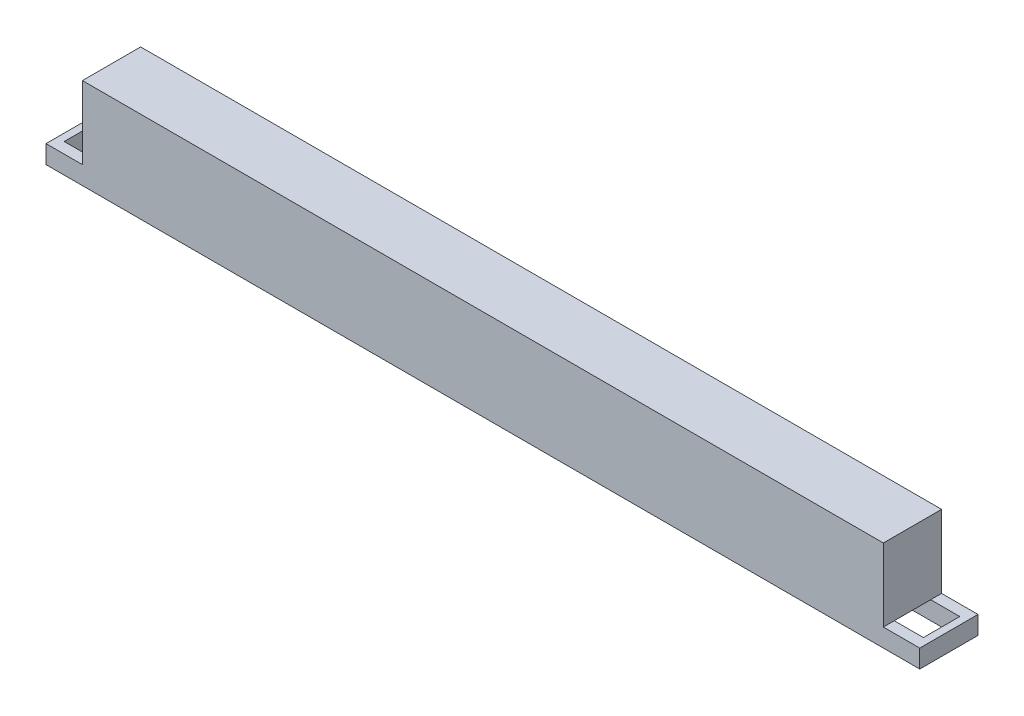
from build123d import *

# Parameters (mm, degrees)
SKETCH1_W           = 240
SKETCH1_H           = 16
BOSS_EXTRUDE1_DEPTH = 5
SKETCH2_W           = 236
SKETCH2_H           = 10
CUT_EXTRUDE1_DEPTH  = 5
SKETCH4_W           = 220
SKETCH4_H           = 16
BOSS_EXTRUDE3_DEPTH = 20


with BuildPart() as part:
    # Sketch1 → Boss-Extrude1 (new body)
    with BuildSketch(Plane(origin=(0, 0, 0), x_dir=(1, 0, 0), z_dir=(0, 1, 0))):
        Rectangle(SKETCH1_W, SKETCH1_H)
    extrude(amount=BOSS_EXTRUDE1_DEPTH)

    # Sketch2 → Cut-Extrude1 (cut)
    with BuildSketch(Plane(origin=(0, 0, 0), x_dir=(1, 0, 0), z_dir=(0, 1, 0))):
        Rectangle(SKETCH2_W, SKETCH2_H)
    extrude(amount=CUT_EXTRUDE1_DEPTH, mode=Mode.SUBTRACT)

    # Sketch4 → Boss-Extrude3 (add)
    with BuildSketch(Plane(origin=(0, 5, 0), x_dir=(1, 0, 0), z_dir=(0, 1, 0))):
        Rectangle(SKETCH4_W, SKETCH4_H)
    extrude(amount=BOSS_EXTRUDE3_DEPTH)


solid = part.part
